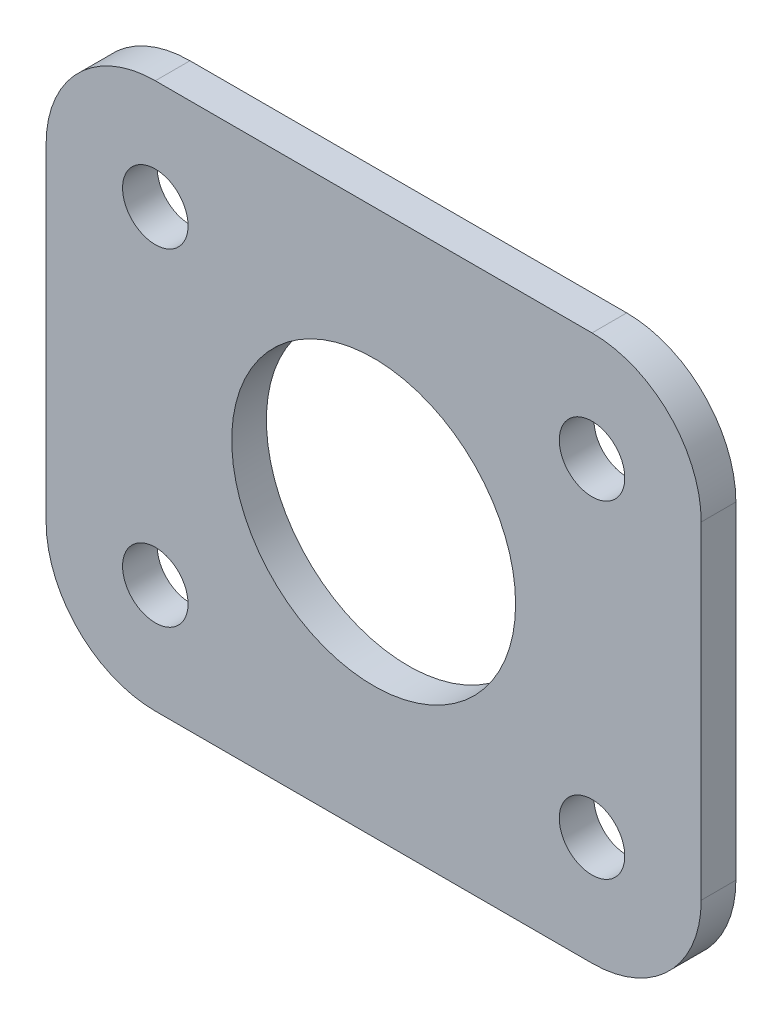
from build123d import *

# Parameters (mm, degrees)
SKETCH1_W           = 30
SKETCH1_H           = 25
SKETCH1_R           = 6.5
SKETCH1_R_2         = 1.5
BOSS_EXTRUDE1_DEPTH = 1.5875
FILLET1_R           = 5


with BuildPart() as part:
    # Sketch1 → Boss-Extrude1 (new body)
    with BuildSketch(Plane.XY):
        with Locations((15, 12.5)):
            Rectangle(SKETCH1_W, SKETCH1_H)
        with Locations((15, 12.5)):
            Circle(SKETCH1_R, mode=Mode.SUBTRACT)
        with Locations((5, 20)):
            Circle(SKETCH1_R_2, mode=Mode.SUBTRACT)
        with Locations((5, 5)):
            Circle(SKETCH1_R_2, mode=Mode.SUBTRACT)
        with Locations(Location((25, 5, 0), (0, 0, 180))):
            Circle(SKETCH1_R_2, mode=Mode.SUBTRACT)
        with Locations(Location((25, 20, 0), (0, 0, 180))):
            Circle(SKETCH1_R_2, mode=Mode.SUBTRACT)
    extrude(amount=BOSS_EXTRUDE1_DEPTH)

    # Fillet1
    fillet1_edges = [part.edges().sort_by_distance(p)[0] for p in [
        (0, 0, 0.79375),
        (0, 25, 0.79375),
        (30, 25, 0.79375),
        (30, 0, 0.79375),
    ]]
    fillet(fillet1_edges, radius=FILLET1_R)


solid = part.part
